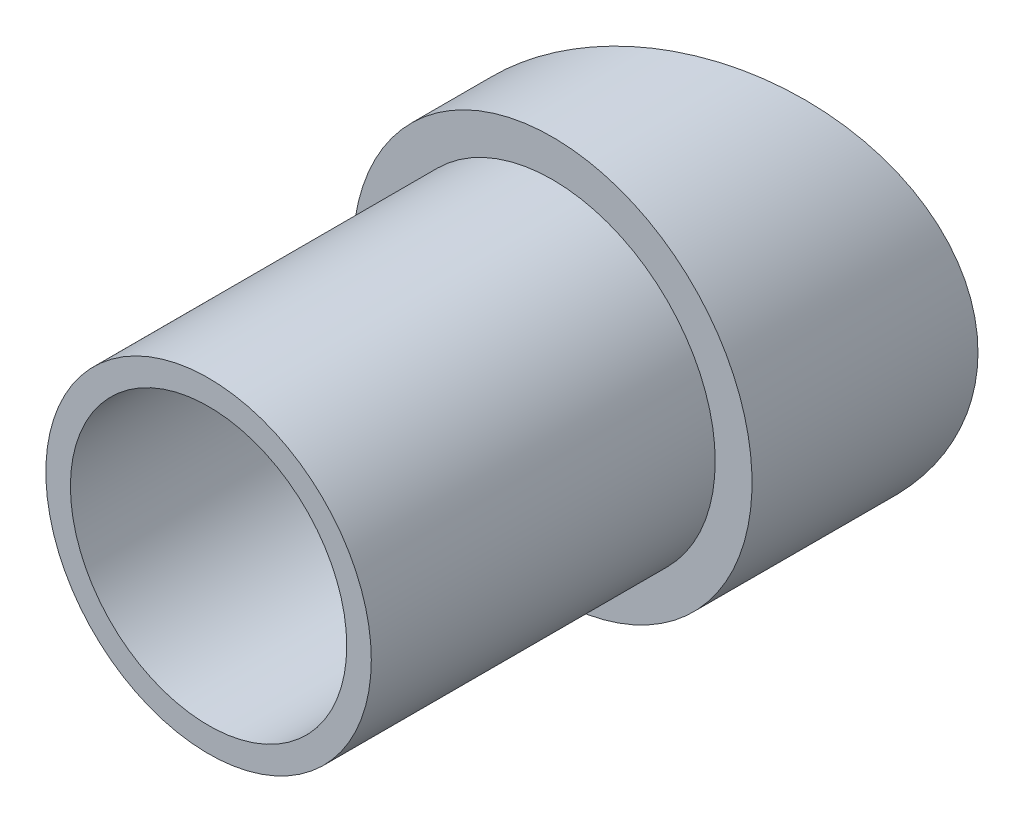
from build123d import *

# Parameters (mm, degrees)
SKETCH2_R               = 13.25
BOSS_EXTRUDE1_DEPTH     = 28
SKETCH3_R               = 16.25
BOSS_EXTRUDE2_DEPTH     = 28
CUT_EXTRUDE1_DEPTH      = 61.532016322
CUT_EXTRUDE1_DEPTH_BACK = 61.532016322
CUT_EXTRUDE2_REACH      = 53.777
SKETCH5_R               = 11.25
SKETCH6_R               = 2.1
CUT_EXTRUDE3_DEPTH      = 5
CUT_EXTRUDE4_DEPTH      = 2


with BuildPart() as part:
    # Sketch2 → Boss-Extrude1 (new body)
    with BuildSketch(Plane.XY):
        Circle(SKETCH2_R)
    extrude(amount=-BOSS_EXTRUDE1_DEPTH)

    # Sketch3 → Boss-Extrude2 (add)
    with BuildSketch(Plane(origin=(0, 0, -28), x_dir=(-1, 0, 0), z_dir=(0, 0, -1))):
        Circle(SKETCH3_R)
    extrude(amount=BOSS_EXTRUDE2_DEPTH)

    # Sketch4 → Cut-Extrude1 (cut, two sides: drawn at the far end of the back side and taken through both)
    with BuildSketch(Plane(origin=(0, 0, 0), x_dir=(1, 0, 0), z_dir=(0, 1, 0)).offset(-CUT_EXTRUDE1_DEPTH_BACK)):
        Polygon((-16.25, 32.602284237), (16.25, 46.397715763), (16.25, 56), (-16.25, 56), align=None)
    extrude(amount=CUT_EXTRUDE1_DEPTH + CUT_EXTRUDE1_DEPTH_BACK, mode=Mode.SUBTRACT)

    # Cut-Extrude2: up to this plane
    cut_extrude2_end = Plane(origin=(-14.296344358, -16.25, -27.999759969), z_dir=(0.3907311284892747, 0, 0.9205048534524399))
    # Sketch5 → Cut-Extrude2 (cut, up to the surface)
    with BuildSketch(Plane.XY, mode=Mode.PRIVATE) as cut_extrude2_sk1:
        Circle(SKETCH5_R)
    cut_extrude2_tool1 = split(extrude(cut_extrude2_sk1.sketch, amount=-CUT_EXTRUDE2_REACH, mode=Mode.PRIVATE), bisect_by=cut_extrude2_end, keep=Keep.BOTH, mode=Mode.PRIVATE)
    add(cut_extrude2_tool1.solids().sort_by_distance((0, 0, 0))[0], mode=Mode.SUBTRACT)

    # Sketch6 → Cut-Extrude3 (cut)
    with BuildSketch(Plane(origin=(-14.206961057, 0, -33.469502817), x_dir=(-0.9205048534524399, 0, 0.3907311284892748), z_dir=(-0.3907311284892748, 0, -0.9205048534524399))):
        with Locations((-15.433879575, 0)):
            Circle(SKETCH6_R)
    extrude(amount=-CUT_EXTRUDE3_DEPTH, mode=Mode.SUBTRACT)

    # Sketch7 → Cut-Extrude4 (cut)
    with BuildSketch(Plane(origin=(-12.253305414, 0, -28.866978549), x_dir=(0.9205048534524399, 0, -0.3907311284892748), z_dir=(0.3907311284892748, 0, 0.9205048534524399))):
        Polygon((19.533879575, 0), (17.483879575, 3.550704156), (13.383879575, 3.550704156), (11.333879575, 0), (13.383879575, -3.550704156), (17.483879575, -3.550704156), align=None)
    extrude(amount=-CUT_EXTRUDE4_DEPTH, mode=Mode.SUBTRACT)


solid = part.part
